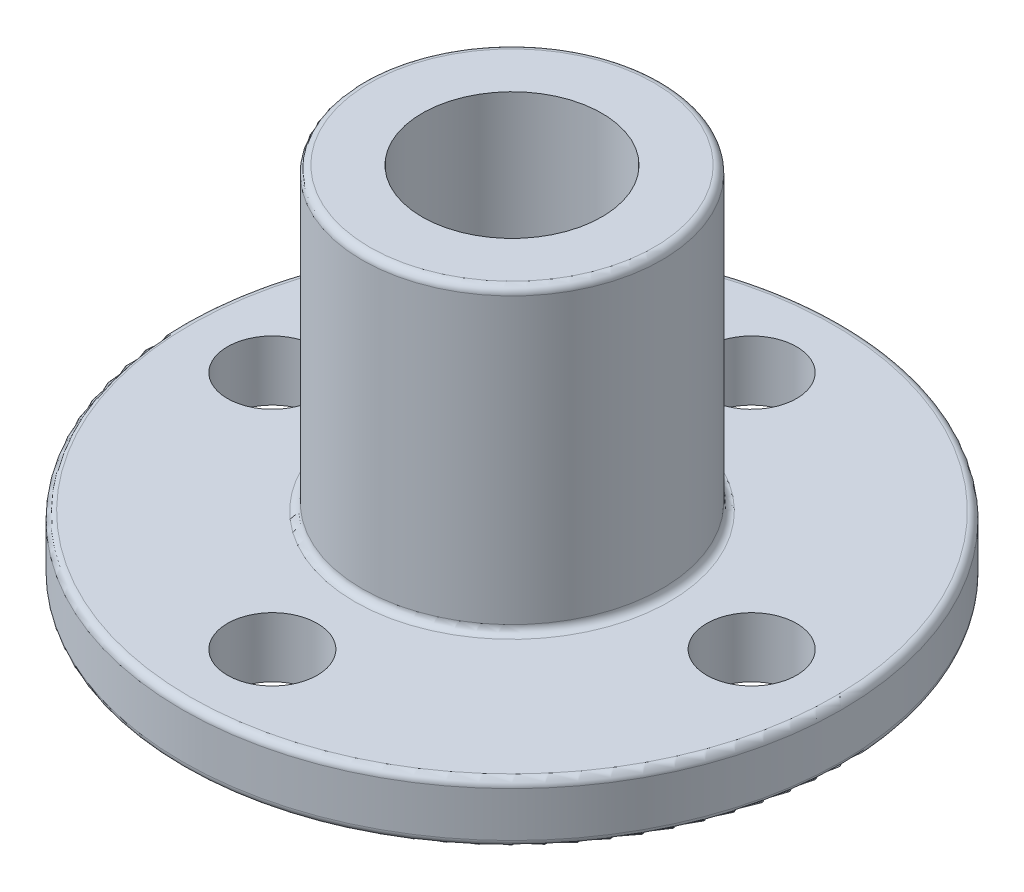
from build123d import *

# Parameters (mm, degrees)
SKETCH_1_R               = 11
EXTRUDE_1_DEPTH          = 2
SKETCH_2_R               = 5
EXTRUDE_2_DEPTH          = 10
SKETCH_3_R               = 3
CUT_EXTRUDE_1_DEPTH      = 20.646882704
SKETCH_4_R               = 1.5
CUT_EXTRUDE_2_DEPTH      = 20.646882704
PATTERN_CIRCULAR_1_COUNT = 4
FILLET_1_R               = 0.25


with BuildPart() as part:
    # ｽｹｯﾁ1 → ﾎﾞｽ - 押し出し1 (new body)
    with BuildSketch(Plane(origin=(0, 0, 0), x_dir=(1, 0, 0), z_dir=(0, 1, 0))):
        with Locations(Location((0, 0, 0), (0, 0, 270))):
            Circle(SKETCH_1_R)
    extrude(amount=EXTRUDE_1_DEPTH)

    # ｽｹｯﾁ2 → ﾎﾞｽ - 押し出し2 (add)
    with BuildSketch(Plane(origin=(0, 2, 0), x_dir=(1, 0, 0), z_dir=(0, 1, 0))):
        with Locations(Location((0, 0, 0), (0, 0, 270))):
            Circle(SKETCH_2_R)
    extrude(amount=EXTRUDE_2_DEPTH)

    # ｽｹｯﾁ3 → ｶｯﾄ - 押し出し1 (cut, through all)
    with BuildSketch(Plane(origin=(0, 12, 0), x_dir=(1, 0, 0), z_dir=(0, 1, 0))):
        with Locations(Location((0, 0, 0), (0, 0, 270))):
            Circle(SKETCH_3_R)
    extrude(amount=-CUT_EXTRUDE_1_DEPTH, mode=Mode.SUBTRACT)

    # ｽｹｯﾁ4 → ｶｯﾄ - 押し出し2 (cut, through all)
    with BuildSketch(Plane.XZ):
        with Locations(Location((0, 8, 0), (0, 0, 270))):
            Circle(SKETCH_4_R)
    cut_extrude_2 = extrude(amount=-CUT_EXTRUDE_2_DEPTH, mode=Mode.SUBTRACT)

    # 円形ﾊﾟﾀｰﾝ1: ｶｯﾄ - 押し出し2 ×4 about axis
    pattern_circular_1_axis = Axis((0, 0, 0), (0, 1, 0))
    for i in range(1, PATTERN_CIRCULAR_1_COUNT):
        add(cut_extrude_2.rotate(pattern_circular_1_axis, i * 360 / PATTERN_CIRCULAR_1_COUNT), mode=Mode.SUBTRACT)

    # ﾌｨﾚｯﾄ1
    fillet_1_edges = [part.edges().sort_by_distance(p)[0] for p in [
        (0, 0, -11),
        (0, 2, -11),
        (0, 2, -5),
        (0, 12, -5),
    ]]
    fillet(fillet_1_edges, radius=FILLET_1_R)


solid = part.part
